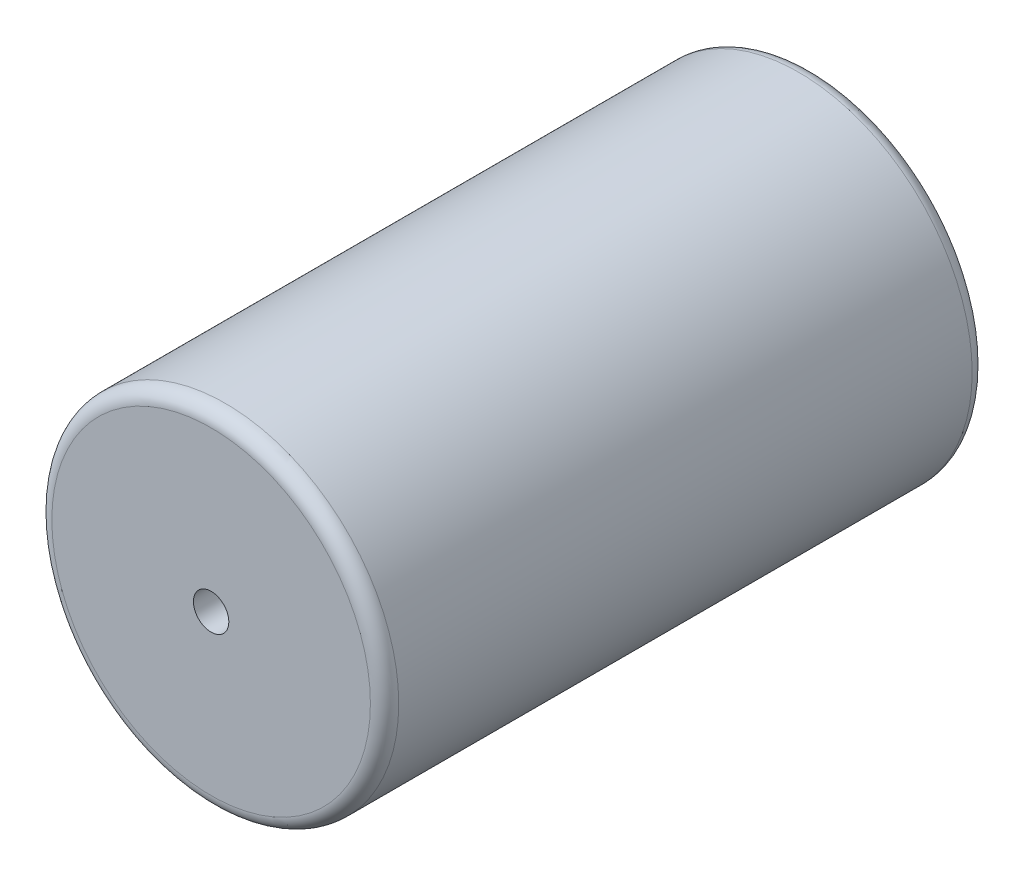
from build123d import *

# Parameters (mm, degrees)
SKETCH1_R           = 24.5
BOSS_EXTRUDE1_DEPTH = 85
FILLET1_R           = 2
SKETCH2_R           = 2.5
CUT_EXTRUDE1_DEPTH  = 7


with BuildPart() as part:
    # Sketch1 → Boss-Extrude1 (new body)
    with BuildSketch(Plane.XY):
        Circle(SKETCH1_R)
    extrude(amount=BOSS_EXTRUDE1_DEPTH)

    # Fillet1
    fillet1_edges = [part.edges().sort_by_distance(p)[0] for p in [
        (-24.5, 0, 0),
        (-24.5, 0, 85),
    ]]
    fillet(fillet1_edges, radius=FILLET1_R)

    # Sketch2 → Cut-Extrude1 (cut)
    with BuildSketch(Plane.XY.offset(85)):
        Circle(SKETCH2_R)
    extrude(amount=-CUT_EXTRUDE1_DEPTH, mode=Mode.SUBTRACT)


solid = part.part
